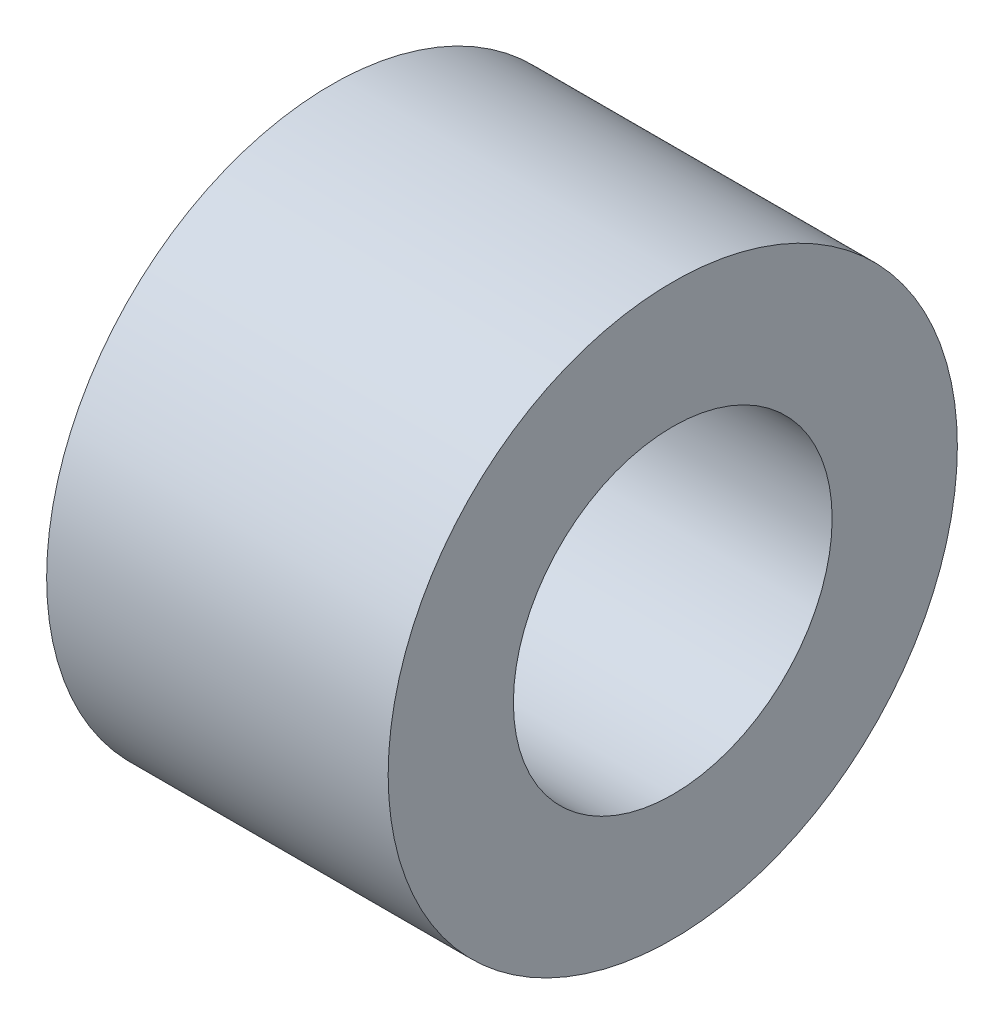
from build123d import *

# Parameters (mm, degrees)
SKETCH1_R           = 2.5
SKETCH1_R_2         = 1.4
BOSS_EXTRUDE1_DEPTH = 3


with BuildPart() as part:
    # Sketch1 → Boss-Extrude1 (new body)
    with BuildSketch(Plane.YZ):
        with Locations(Location((0, 0, 0), (0, 0, 270))):
            Circle(SKETCH1_R)
        with Locations(Location((0, 0, 0), (0, 0, 270))):
            Circle(SKETCH1_R_2, mode=Mode.SUBTRACT)
    extrude(amount=BOSS_EXTRUDE1_DEPTH)


solid = part.part
